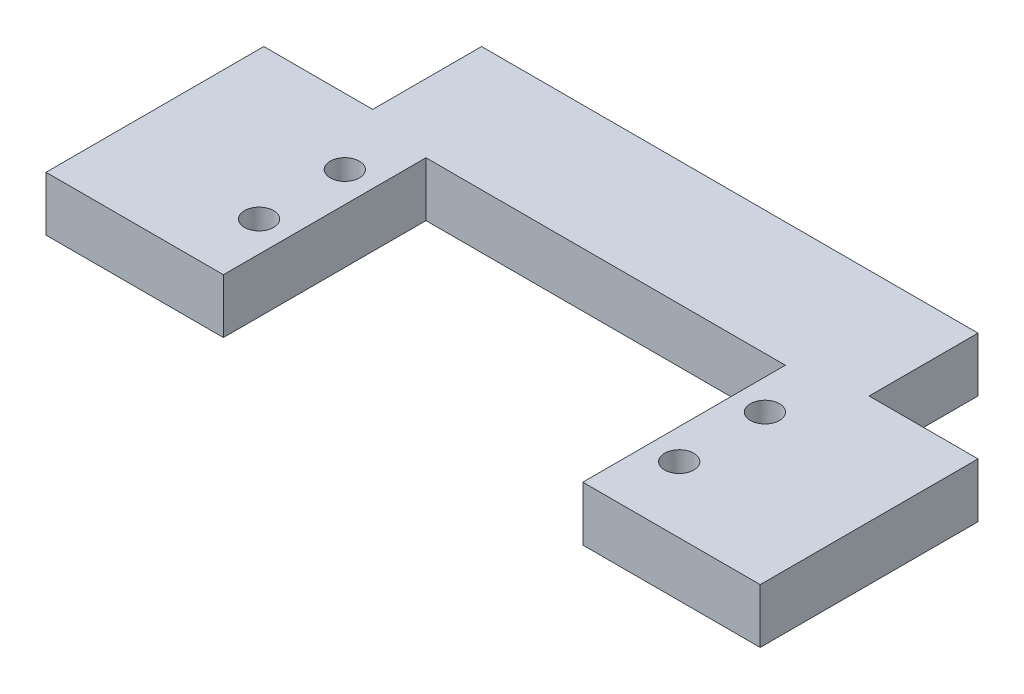
from build123d import *

# Parameters (mm, degrees)
SKETCH1_R           = 1.70053
SKETCH1_W           = 41.91
SKETCH1_H           = 21.844
BOSS_EXTRUDE1_DEPTH = 6.35
CUT_EXTRUDE1_DEPTH  = 50.192057177


with BuildPart() as part:
    # Sketch1 → Boss-Extrude1 (new body)
    with BuildSketch(Plane(origin=(0, 0, 0), x_dir=(1, 0, 0), z_dir=(0, 1, 0))):
        Polygon((-6.35, 25.4), (6.35, 25.4), (28.94584, 25.4), (28.94584, 12.7), (41.64584, 12.7), (41.64584, -12.7), (28.94584, -12.7), (28.94584, -25.4), (6.35, -25.4), (-6.35, -25.4), (-28.94584, -25.4), (-28.94584, -12.7), (-41.64584, -12.7), (-41.64584, 12.7), (-28.94584, 12.7), (-28.94584, 25.4), align=None)
        with Locations(Location((-24.49957, 5, 0), (0, 0, 270))):
            Circle(SKETCH1_R, mode=Mode.SUBTRACT)
        with Locations(Location((-24.49957, -5, 0), (0, 0, 270))):
            Circle(SKETCH1_R, mode=Mode.SUBTRACT)
        with Locations(Location((24.49957, -5, 0), (0, 0, 270))):
            Circle(SKETCH1_R, mode=Mode.SUBTRACT)
        with Locations(Location((24.49957, 5, 0), (0, 0, 270))):
            Circle(SKETCH1_R, mode=Mode.SUBTRACT)
        Rectangle(SKETCH1_W, SKETCH1_H, mode=Mode.SUBTRACT)
    extrude(amount=BOSS_EXTRUDE1_DEPTH)

    # Sketch2 → Cut-Extrude1 (cut, through all)
    with BuildSketch(Plane(origin=(0, 6.35, 0), x_dir=(1, 0, 0), z_dir=(0, 1, 0))):
        Polygon((-28.94584, -12.7), (-20.955, -12.7), (-20.955, -10.922), (20.955, -10.922), (20.955, -12.7), (28.94584, -12.7), (28.94584, -25.4), (-28.94584, -25.4), align=None)
    extrude(amount=-CUT_EXTRUDE1_DEPTH, mode=Mode.SUBTRACT)


solid = part.part
